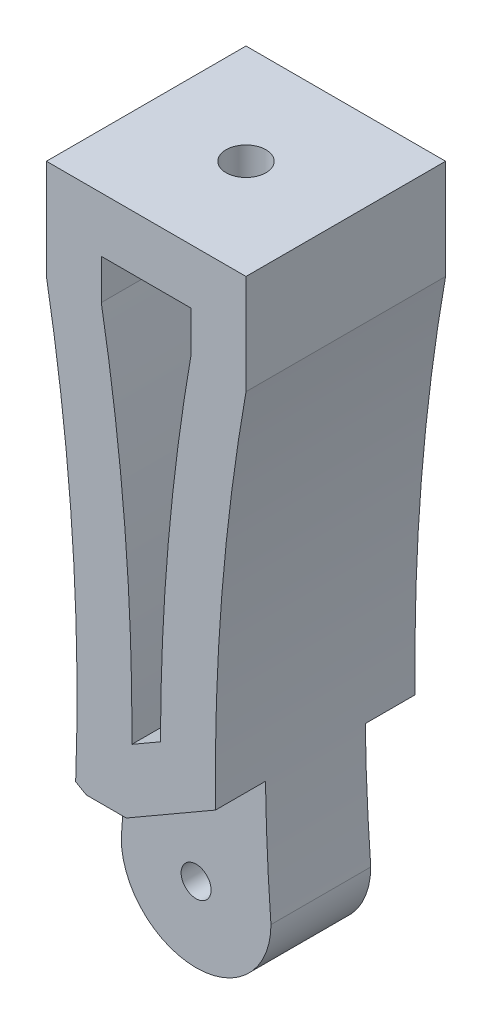
from build123d import *

# Parameters (mm, degrees)
CROQUIS1_R              = 1.5
SALIENTE_EXTRUIR1_DEPTH = 20
CORTAR_EXTRUIR1_START   = -5
CORTAR_EXTRUIR1_DEPTH   = 5
CORTAR_EXTRUIR2_DEPTH   = 5
CORTAR_EXTRUIR3_DEPTH   = 65.031242374
CROQUIS5_R              = 2
CORTAR_EXTRUIR4_DEPTH   = 10


with BuildPart() as part:
    # Croquis1 → Saliente-Extruir1 (new body)
    # profile 1 of 2: a face of its own
    with BuildSketch(Plane.XY):
        with BuildLine():
            ThreePointArc((7.420644355, 1.088134807), (7.207357835, 25.623325873), (10, 50))
            Line((10, 50), (10, 60))
            Line((10, 60), (-10, 60))
            Line((-10, 60), (-10, 50))
            ThreePointArc((-10, 50), (-7.207357835, 25.623325873), (-7.420644355, 1.088134807))
            ThreePointArc((-7.420644355, 1.088134807), (0, 7.5), (7.420644355, 1.088134807))
        make_face()
    # profile 2 of 2: a face of its own
    with BuildSketch(Plane.XY):
        with BuildLine():
            ThreePointArc((7.5, 0), (7.459580187, 0.544013292), (7.420644355, 1.088134807))
            ThreePointArc((7.420644355, 1.088134807), (0, 7.5), (-7.420644355, 1.088134807))
            ThreePointArc((-7.420644355, 1.088134807), (-7.459580187, 0.544013292), (-7.5, 0))
            ThreePointArc((-7.5, 0), (0, -7.5), (7.5, 0))
        make_face()
        Circle(CROQUIS1_R, mode=Mode.SUBTRACT)
    extrude(amount=SALIENTE_EXTRUIR1_DEPTH)

    # Croquis2 → Cortar-Extruir1 (cut)
    with BuildSketch(Plane.XY.offset(20).offset(CORTAR_EXTRUIR1_START)):
        with BuildLine():
            Line((-7.069523462, 7.617489658), (-6, 7))
            Line((-6, 7), (-2, 7))
            Line((-2, 7), (6.951202379, 12.167979103))
            ThreePointArc((6.951202379, 12.167979103), (7.132948314, 6.079810741), (7.5, 0))
            ThreePointArc((7.5, 0), (0, -7.5), (-7.5, 0))
            ThreePointArc((-7.5, 0), (-7.24843422, 3.806691903), (-7.069523462, 7.617489658))
        make_face()
    extrude(amount=CORTAR_EXTRUIR1_DEPTH, mode=Mode.SUBTRACT)

    # Croquis3 → Cortar-Extruir2 (cut)
    with BuildSketch(Plane(origin=(0, 0, 0), x_dir=(-1, 0, 0), z_dir=(0, 0, -1))):
        with BuildLine():
            Line((-6.951202379, 12.167979103), (2, 7))
            Line((2, 7), (6, 7))
            Line((6, 7), (7.069523462, 7.617489658))
            ThreePointArc((7.069523462, 7.617489658), (7.24843422, 3.806691903), (7.5, 0))
            ThreePointArc((7.5, 0), (0, -7.5), (-7.5, 0))
            ThreePointArc((-7.5, 0), (-7.132948314, 6.079810741), (-6.951202379, 12.167979103))
        make_face()
    extrude(amount=-CORTAR_EXTRUIR2_DEPTH, mode=Mode.SUBTRACT)

    # Croquis4 → Cortar-Extruir3 (cut, through all)
    with BuildSketch(Plane.XY.offset(20)):
        with BuildLine():
            Line((-1.434704258, 13.67722661), (1.429981311, 15.331153594))
            ThreePointArc((1.429981311, 15.331153594), (2.209232224, 32.971789387), (4.5, 50.480405727))
            Line((4.5, 50.480405727), (4.5, 54.5))
            Line((4.5, 54.5), (-4.5, 54.5))
            Line((-4.5, 54.5), (-4.5, 50.480405727))
            ThreePointArc((-4.5, 50.480405727), (-2.13893455, 32.147814145), (-1.434704258, 13.67722661))
        make_face()
    extrude(amount=-CORTAR_EXTRUIR3_DEPTH, mode=Mode.SUBTRACT)

    # Croquis5 → Cortar-Extruir4 (cut)
    with BuildSketch(Plane(origin=(0, 60, 0), x_dir=(1, 0, 0), z_dir=(0, 1, 0))):
        with Locations(Location((0, -10, 0), (0, 0, 270))):
            Circle(CROQUIS5_R)
    extrude(amount=-CORTAR_EXTRUIR4_DEPTH, mode=Mode.SUBTRACT)


solid = part.part
